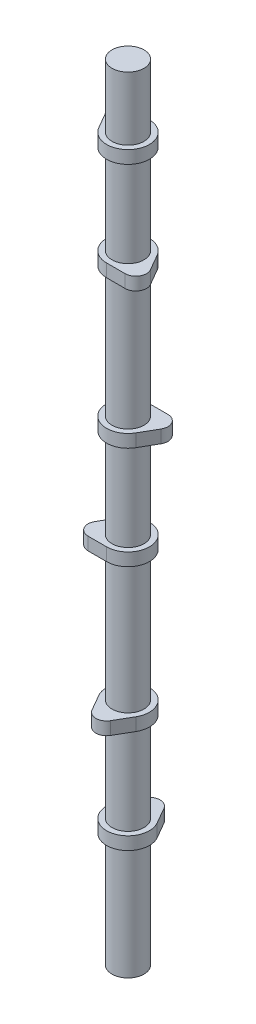
from build123d import *

# Parameters (mm, degrees)
BOSS_EXTRUDE3_DEPTH   = 7.62
LPATTERN1_COUNT       = 2
LPATTERN1_PITCH       = 60.96
BODY_MOVE_COPY1_ANGLE = 180
LPATTERN2_COUNT       = 3
LPATTERN2_PITCH       = 146.05
BODY_MOVE_COPY2_ANGLE = 120
BODY_MOVE_COPY3_ANGLE = 120
BOSS_EXTRUDE4_START   = -67.8
SKETCH2_R             = 9.5
BOSS_EXTRUDE4_DEPTH   = 466.09


with BuildPart() as part:
    # Sketch1 → Boss-Extrude3 (new body)
    with BuildSketch(Plane(origin=(0, 0, 0), x_dir=(1, 0, 0), z_dir=(0, 1, 0))):
        with BuildLine():
            Line((-5.499261314, 15.875), (-10.998522628, 6.35))
            ThreePointArc((-10.998522628, 6.35), (0, -12.7), (10.998522628, 6.35))
            Line((10.998522628, 6.35), (5.499261314, 15.875))
            ThreePointArc((5.499261314, 15.875), (0, 19.05), (-5.499261314, 15.875))
        make_face()
    extrude(amount=BOSS_EXTRUDE3_DEPTH)


with BuildPart() as lpattern1_1:
    # LPattern1: pattern copy
    add(part.part.moved(Location(Vector(0, 1, 0) * (1 * LPATTERN1_PITCH))))


with BuildPart() as lpattern1_1_1:
    # Body-Move/Copy1: moved
    add(lpattern1_1.part.rotate(Axis((0, 0, 0), (0, 1, 0)), BODY_MOVE_COPY1_ANGLE))


with BuildPart() as lpattern2_1:
    # LPattern2: pattern copy
    add(part.part.moved(Location(Vector(0, 1, 0) * (1 * LPATTERN2_PITCH))))


with BuildPart() as lpattern2_2:
    # LPattern2: pattern copy
    add(part.part.moved(Location(Vector(0, 1, 0) * (2 * LPATTERN2_PITCH))))


with BuildPart() as lpattern2_3:
    # LPattern2: pattern copy
    add(lpattern1_1_1.part.moved(Location(Vector(0, 1, 0) * (1 * LPATTERN2_PITCH))))


with BuildPart() as lpattern2_4:
    # LPattern2: pattern copy
    add(lpattern1_1_1.part.moved(Location(Vector(0, 1, 0) * (2 * LPATTERN2_PITCH))))


with BuildPart() as lpattern2_3_1:
    # Body-Move/Copy2: moved
    add(lpattern2_3.part.rotate(Axis((0, 0, 0), (0, 1, 0)), BODY_MOVE_COPY2_ANGLE))


with BuildPart() as lpattern2_1_1:
    # Body-Move/Copy2: moved
    add(lpattern2_1.part.rotate(Axis((0, 0, 0), (0, 1, 0)), BODY_MOVE_COPY2_ANGLE))


with BuildPart() as lpattern2_4_1:
    # Body-Move/Copy3: moved
    add(lpattern2_4.part.rotate(Axis((0, 0, 0), (0, -1, 0)), BODY_MOVE_COPY3_ANGLE))


with BuildPart() as lpattern2_2_1:
    # Body-Move/Copy3: moved
    add(lpattern2_2.part.rotate(Axis((0, 0, 0), (0, -1, 0)), BODY_MOVE_COPY3_ANGLE))


with BuildPart() as part_1:
    add(part.part)

    add(lpattern1_1_1.part)  # Boss-Extrude4 merges LPattern1_1

    add(lpattern2_1_1.part)  # Boss-Extrude4 merges LPattern2_1

    add(lpattern2_2_1.part)  # Boss-Extrude4 merges LPattern2_2

    add(lpattern2_3_1.part)  # Boss-Extrude4 merges LPattern2_3

    add(lpattern2_4_1.part)  # Boss-Extrude4 merges LPattern2_4
    # Sketch2 → Boss-Extrude4 (add)
    with BuildSketch(Plane(origin=(0, 0, 0), x_dir=(1, 0, 0), z_dir=(0, 1, 0)).offset(BOSS_EXTRUDE4_START)):
        Circle(SKETCH2_R)
    extrude(amount=BOSS_EXTRUDE4_DEPTH)


solid = part_1.part
